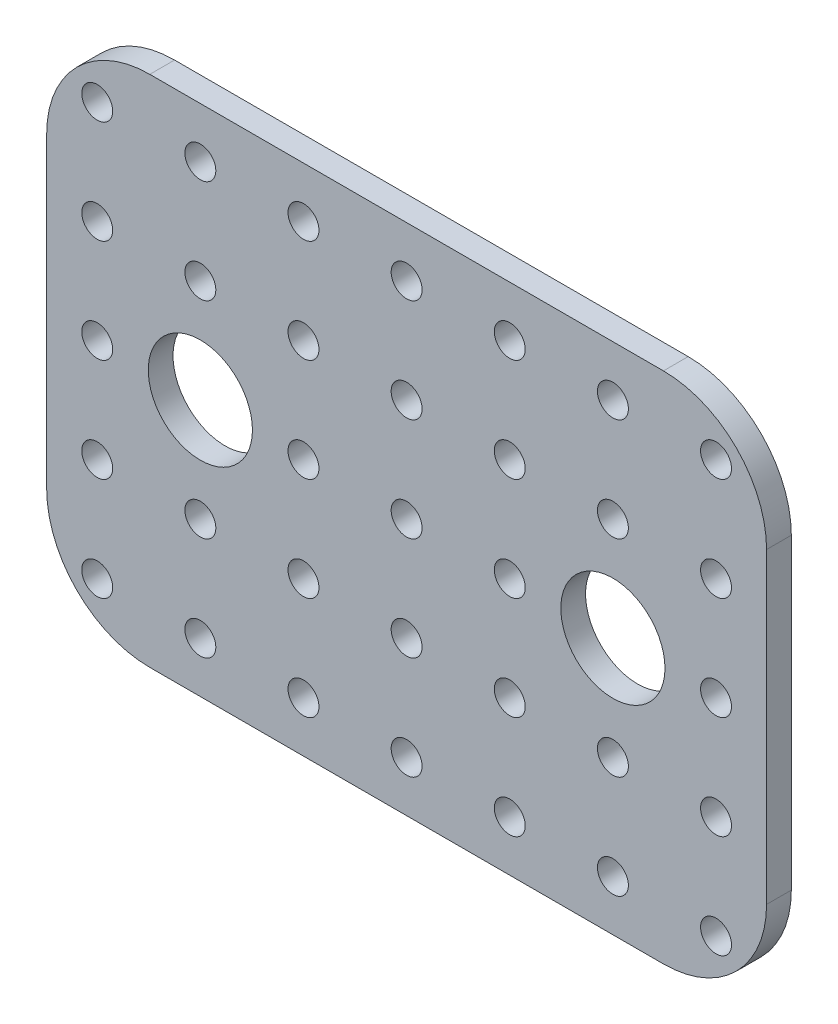
from build123d import *

# Parameters (mm, degrees)
SKETCH_1_W          = 69.8
SKETCH_1_H          = 49.8
EXTRUDE_1_DEPTH     = 2.4
SKETCH_2_R          = 1.5
SKETCH_2_R_2        = 5.05
CUT_EXTRUDE_3_DEPTH = 10
FILLET_4_R          = 10
FILLET_5_R          = 10


with BuildPart() as part:
    # 草图1 → 凸台-拉伸1 (new body)
    with BuildSketch(Plane.XY):
        Rectangle(SKETCH_1_W, SKETCH_1_H)
    extrude(amount=EXTRUDE_1_DEPTH)

    # 草图2 → 切除-拉伸3 (cut)
    # profile 1 of 35: a face of its own
    with BuildSketch(Plane.XY.offset(2.4)):
        with Locations((30, 20)):
            Circle(SKETCH_2_R)
    # profile 2 of 35: a face of its own
    with BuildSketch(Plane.XY.offset(2.4)):
        with Locations((20, 20)):
            Circle(SKETCH_2_R)
    # profile 3 of 35: a face of its own
    with BuildSketch(Plane.XY.offset(2.4)):
        with Locations((10, 20)):
            Circle(SKETCH_2_R)
    # profile 4 of 35: a face of its own
    with BuildSketch(Plane.XY.offset(2.4)):
        with Locations((0, 20)):
            Circle(SKETCH_2_R)
    # profile 5 of 35: a face of its own
    with BuildSketch(Plane.XY.offset(2.4)):
        with Locations((-10, 20)):
            Circle(SKETCH_2_R)
    # profile 6 of 35: a face of its own
    with BuildSketch(Plane.XY.offset(2.4)):
        with Locations((-20, 20)):
            Circle(SKETCH_2_R)
    # profile 7 of 35: a face of its own
    with BuildSketch(Plane.XY.offset(2.4)):
        with Locations((-30, 20)):
            Circle(SKETCH_2_R)
    # profile 8 of 35: a face of its own
    with BuildSketch(Plane.XY.offset(2.4)):
        with Locations((20, 10)):
            Circle(SKETCH_2_R)
    # profile 9 of 35: a face of its own
    with BuildSketch(Plane.XY.offset(2.4)):
        with Locations((10, 10)):
            Circle(SKETCH_2_R)
    # profile 10 of 35: a face of its own
    with BuildSketch(Plane.XY.offset(2.4)):
        with Locations((0, 10)):
            Circle(SKETCH_2_R)
    # profile 11 of 35: a face of its own
    with BuildSketch(Plane.XY.offset(2.4)):
        with Locations((-10, 10)):
            Circle(SKETCH_2_R)
    # profile 12 of 35: a face of its own
    with BuildSketch(Plane.XY.offset(2.4)):
        with Locations((-20, 10)):
            Circle(SKETCH_2_R)
    # profile 13 of 35: a face of its own
    with BuildSketch(Plane.XY.offset(2.4)):
        with Locations((-30, 10)):
            Circle(SKETCH_2_R)
    # profile 14 of 35: a face of its own
    with BuildSketch(Plane.XY.offset(2.4)):
        with Locations((10, 0)):
            Circle(SKETCH_2_R)
    # profile 15 of 35: a face of its own
    with BuildSketch(Plane.XY.offset(2.4)):
        Circle(SKETCH_2_R)
    # profile 16 of 35: a face of its own
    with BuildSketch(Plane.XY.offset(2.4)):
        with Locations((-10, 0)):
            Circle(SKETCH_2_R)
    # profile 17 of 35: a face of its own
    with BuildSketch(Plane.XY.offset(2.4)):
        with Locations((-30, 0)):
            Circle(SKETCH_2_R)
    # profile 18 of 35: a face of its own
    with BuildSketch(Plane.XY.offset(2.4)):
        with Locations((20, -10)):
            Circle(SKETCH_2_R)
    # profile 19 of 35: a face of its own
    with BuildSketch(Plane.XY.offset(2.4)):
        with Locations((10, -10)):
            Circle(SKETCH_2_R)
    # profile 20 of 35: a face of its own
    with BuildSketch(Plane.XY.offset(2.4)):
        with Locations((0, -10)):
            Circle(SKETCH_2_R)
    # profile 21 of 35: a face of its own
    with BuildSketch(Plane.XY.offset(2.4)):
        with Locations((-10, -10)):
            Circle(SKETCH_2_R)
    # profile 22 of 35: a face of its own
    with BuildSketch(Plane.XY.offset(2.4)):
        with Locations((-20, -10)):
            Circle(SKETCH_2_R)
    # profile 23 of 35: a face of its own
    with BuildSketch(Plane.XY.offset(2.4)):
        with Locations((-30, -10)):
            Circle(SKETCH_2_R)
    # profile 24 of 35: a face of its own
    with BuildSketch(Plane.XY.offset(2.4)):
        with Locations((20, -20)):
            Circle(SKETCH_2_R)
    # profile 25 of 35: a face of its own
    with BuildSketch(Plane.XY.offset(2.4)):
        with Locations((10, -20)):
            Circle(SKETCH_2_R)
    # profile 26 of 35: a face of its own
    with BuildSketch(Plane.XY.offset(2.4)):
        with Locations((0, -20)):
            Circle(SKETCH_2_R)
    # profile 27 of 35: a face of its own
    with BuildSketch(Plane.XY.offset(2.4)):
        with Locations((-10, -20)):
            Circle(SKETCH_2_R)
    # profile 28 of 35: a face of its own
    with BuildSketch(Plane.XY.offset(2.4)):
        with Locations((-20, -20)):
            Circle(SKETCH_2_R)
    # profile 29 of 35: a face of its own
    with BuildSketch(Plane.XY.offset(2.4)):
        with Locations((-30, -20)):
            Circle(SKETCH_2_R)
    # profile 30 of 35: a face of its own
    with BuildSketch(Plane.XY.offset(2.4)):
        with Locations((30, 10)):
            Circle(SKETCH_2_R)
    # profile 31 of 35: a face of its own
    with BuildSketch(Plane.XY.offset(2.4)):
        with Locations((30, 0)):
            Circle(SKETCH_2_R)
    # profile 32 of 35: a face of its own
    with BuildSketch(Plane.XY.offset(2.4)):
        with Locations((30, -10)):
            Circle(SKETCH_2_R)
    # profile 33 of 35: a face of its own
    with BuildSketch(Plane.XY.offset(2.4)):
        with Locations((30, -20)):
            Circle(SKETCH_2_R)
    # profile 34 of 35: a face of its own
    with BuildSketch(Plane.XY.offset(2.4)):
        with Locations((-20, 0)):
            Circle(SKETCH_2_R_2)
        with Locations((-20, 0)):
            Circle(SKETCH_2_R, mode=Mode.SUBTRACT)
    # profile 35 of 35: a face of its own
    with BuildSketch(Plane.XY.offset(2.4)):
        with Locations((20, 0)):
            Circle(SKETCH_2_R_2)
        with Locations((20, 0)):
            Circle(SKETCH_2_R, mode=Mode.SUBTRACT)
    extrude(amount=-CUT_EXTRUDE_3_DEPTH, mode=Mode.SUBTRACT)


with BuildPart() as cut_extrude_3_kept_piece:
    # of the separate pieces the step leaves, the one the design keeps (cut_extrude_3_pieces_kept)
    add(part.part.solids().sort_by_distance((34.9, -24.9, 0))[0])

    # 圆角4
    fillet_4_edges = [cut_extrude_3_kept_piece.edges().sort_by_distance(p)[0] for p in [
        (34.9, 24.9, 1.2),
    ]]
    fillet(fillet_4_edges, radius=FILLET_4_R)

    # 圆角5
    fillet_5_edges = [cut_extrude_3_kept_piece.edges().sort_by_distance(p)[0] for p in [
        (-34.9, 24.9, 1.2),
        (-34.9, -24.9, 1.2),
        (34.9, -24.9, 1.2),
    ]]
    fillet(fillet_5_edges, radius=FILLET_5_R)


solid = cut_extrude_3_kept_piece.part
